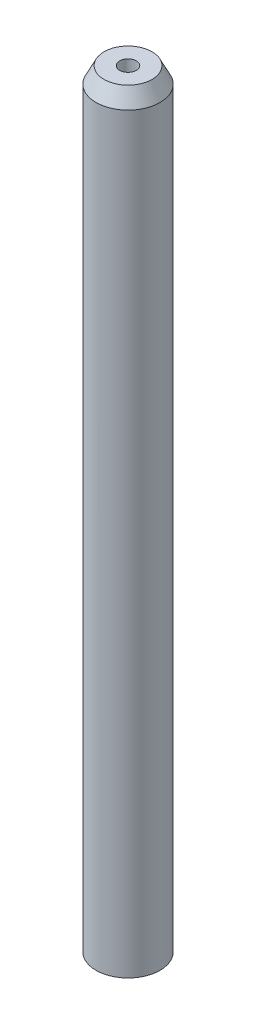
from build123d import *

# Parameters (mm, degrees)
SKETCH1_R                 = 6.35
POSTBODY_DEPTH            = 152.4
M4X0_7_TAPPED_HOLE1_D     = 3.3
M4X0_7_TAPPED_HOLE1_DEPTH = 9.525
M4X0_7_TAPPED_HOLE1_TIP   = 0.991420021
M6X1_0_TAPPED_HOLE1_D     = 5
M6X1_0_TAPPED_HOLE1_DEPTH = 12.7
M6X1_0_TAPPED_HOLE1_TIP   = 1.502151548


with BuildPart() as part:
    # Sketch1 → PostBody (new body)
    with BuildSketch(Plane(origin=(0, 0, 0), x_dir=(1, 0, 0), z_dir=(0, 1, 0))):
        with Locations(Location((0, 0, 0), (0, 0, 90))):
            Circle(SKETCH1_R)
    extrude(amount=POSTBODY_DEPTH)

    # TopCut: sweep along a path in Sketch5
    with BuildLine(Plane(origin=(0, 152.4, 0), x_dir=(1, 0, 0), z_dir=(0, 1, 0))) as topcut_path:
        CenterArc((0, 0), 4.748740119, 0, 360)
    # Sketch4 → TopCut (sweep, cut)
    with BuildSketch(Plane.XY):
        Polygon((6.35, 152.4), (6.35, 149.225), (4.7625, 152.4), align=None)
    sweep(path=topcut_path.line, mode=Mode.SUBTRACT)

    # M4x0.7 Tapped Hole1
    with Locations(Plane(origin=(0, 152.4, 0), x_dir=(1, 0, 0), z_dir=(0, 1, 0))):
        with Locations((0, 0)):
            Hole(M4X0_7_TAPPED_HOLE1_D / 2, depth=M4X0_7_TAPPED_HOLE1_DEPTH)
            with Locations((0, 0, -(M4X0_7_TAPPED_HOLE1_DEPTH + M4X0_7_TAPPED_HOLE1_TIP / 2))):  # 118° drill point
                Cone(0, M4X0_7_TAPPED_HOLE1_D / 2, M4X0_7_TAPPED_HOLE1_TIP, mode=Mode.SUBTRACT)

    # M6x1.0 Tapped Hole1
    with Locations(Plane(origin=(0, 0, 0), x_dir=(-1, 0, 0), z_dir=(0, -1, 0))):
        with Locations((0, 0)):
            Hole(M6X1_0_TAPPED_HOLE1_D / 2, depth=M6X1_0_TAPPED_HOLE1_DEPTH)
            with Locations((0, 0, -(M6X1_0_TAPPED_HOLE1_DEPTH + M6X1_0_TAPPED_HOLE1_TIP / 2))):  # 118° drill point
                Cone(0, M6X1_0_TAPPED_HOLE1_D / 2, M6X1_0_TAPPED_HOLE1_TIP, mode=Mode.SUBTRACT)


solid = part.part
